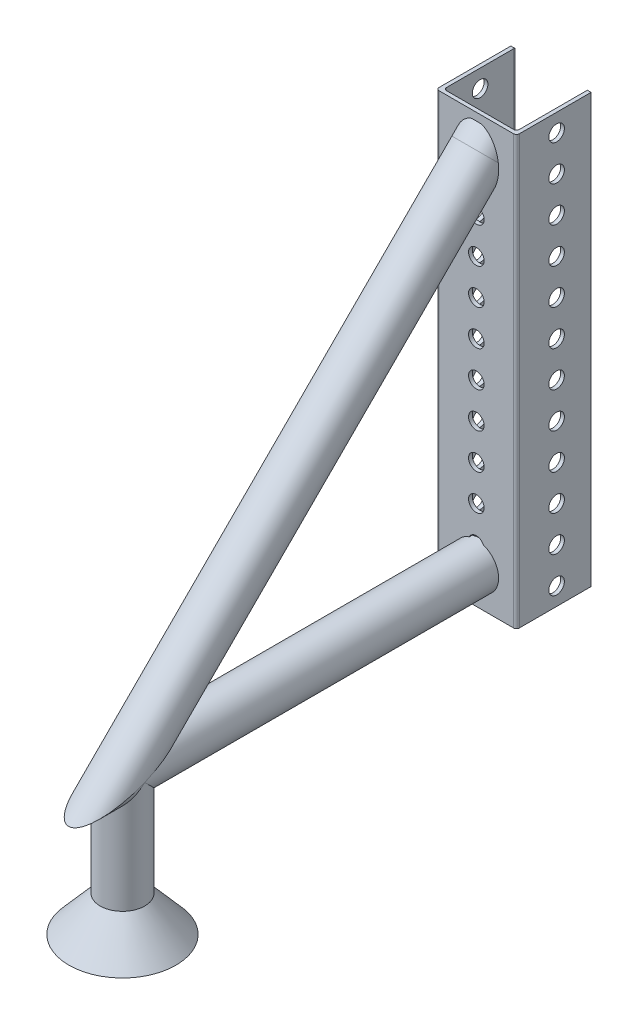
from build123d import *

# Parameters (mm, degrees)
BOSS_EXTRUDE1_DEPTH             = 304.8
SKETCH2_R                       = 5.55625
CUT_EXTRUDE1_DEPTH              = 304.8
SKETCH3_R                       = 5.55625
CUT_EXTRUDE2_DEPTH              = 304.8
SKETCH4_W                       = 57.15
SKETCH4_H                       = 304.8
CUT_EXTRUDE3_DEPTH              = 4
SWEEP1_PROFILE_R                = 15.875
BOSS_EXTRUDE2_REACH             = 426.804
BOSS_EXTRUDE2_END_RADIUS        = 15.875
SKETCH18_R                      = 15.875
BOSS_EXTRUDE2_DIRECTION_2_DEPTH = 25.4


with BuildPart() as part:
    # Sketch1 → Boss-Extrude1 (new body)
    with BuildSketch(Plane(origin=(0, 0, 0), x_dir=(1, 0, 0), z_dir=(0, 1, 0))):
        with BuildLine():
            Line((2, 0), (55.15, 0))
            ThreePointArc((55.15, 0), (56.564213562, 0.585786438), (57.15, 2))
            Line((57.15, 2), (57.15, 55.15))
            ThreePointArc((57.15, 55.15), (56.564213562, 56.564213562), (55.15, 57.15))
            Line((55.15, 57.15), (2, 57.15))
            ThreePointArc((2, 57.15), (0.585786438, 56.564213562), (0, 55.15))
            Line((0, 55.15), (0, 2))
            ThreePointArc((0, 2), (0.585786438, 0.585786438), (2, 0))
        make_face()
        with BuildLine():
            Line((4.667, 54.483), (52.483, 54.483))
            ThreePointArc((52.483, 54.483), (53.897213562, 53.897213562), (54.483, 52.483))
            Line((54.483, 52.483), (54.483, 4.667))
            ThreePointArc((54.483, 4.667), (53.897213562, 3.252786438), (52.483, 2.667))
            Line((52.483, 2.667), (4.667, 2.667))
            ThreePointArc((4.667, 2.667), (3.252786438, 3.252786438), (2.667, 4.667))
            Line((2.667, 4.667), (2.667, 52.483))
            ThreePointArc((2.667, 52.483), (3.252786438, 53.897213562), (4.667, 54.483))
        make_face(mode=Mode.SUBTRACT)
    extrude(amount=BOSS_EXTRUDE1_DEPTH)

    # Sketch2 → Cut-Extrude1 (cut)
    with BuildSketch(Plane.XY):
        with Locations((28.575, 292.1)):
            Circle(SKETCH2_R)
        with Locations((28.575, 266.7)):
            Circle(SKETCH2_R)
        with Locations((28.575, 241.3)):
            Circle(SKETCH2_R)
        with Locations((28.575, 215.9)):
            Circle(SKETCH2_R)
        with Locations((28.575, 190.5)):
            Circle(SKETCH2_R)
        with Locations((28.575, 165.1)):
            Circle(SKETCH2_R)
        with Locations((28.575, 139.7)):
            Circle(SKETCH2_R)
        with Locations((28.575, 114.3)):
            Circle(SKETCH2_R)
        with Locations((28.575, 88.9)):
            Circle(SKETCH2_R)
        with Locations((28.575, 63.5)):
            Circle(SKETCH2_R)
        with Locations((28.575, 38.1)):
            Circle(SKETCH2_R)
        with Locations((28.575, 12.7)):
            Circle(SKETCH2_R)
    extrude(amount=-CUT_EXTRUDE1_DEPTH, mode=Mode.SUBTRACT)

    # Sketch3 → Cut-Extrude2 (cut)
    with BuildSketch(Plane(origin=(57.15, 0, -57.15), x_dir=(0, 0, 1), z_dir=(-1, 0, 0))):
        with Locations((28.575, 292.1)):
            Circle(SKETCH3_R)
        with Locations((28.575, 266.7)):
            Circle(SKETCH3_R)
        with Locations((28.575, 241.3)):
            Circle(SKETCH3_R)
        with Locations((28.575, 215.9)):
            Circle(SKETCH3_R)
        with Locations((28.575, 190.5)):
            Circle(SKETCH3_R)
        with Locations((28.575, 165.1)):
            Circle(SKETCH3_R)
        with Locations((28.575, 139.7)):
            Circle(SKETCH3_R)
        with Locations((28.575, 114.3)):
            Circle(SKETCH3_R)
        with Locations((28.575, 88.9)):
            Circle(SKETCH3_R)
        with Locations((28.575, 63.5)):
            Circle(SKETCH3_R)
        with Locations((28.575, 38.1)):
            Circle(SKETCH3_R)
        with Locations((28.575, 12.7)):
            Circle(SKETCH3_R)
    extrude(amount=CUT_EXTRUDE2_DEPTH, mode=Mode.SUBTRACT)

    # Sketch4 → Cut-Extrude3 (cut)
    with BuildSketch(Plane(origin=(0, 0, -57.15), x_dir=(-1, 0, 0), z_dir=(0, 0, -1))):
        with Locations((-28.575, 152.4)):
            Rectangle(SKETCH4_W, SKETCH4_H)
    extrude(amount=-CUT_EXTRUDE3_DEPTH, mode=Mode.SUBTRACT)

    # Sweep1: sweep along a path in Sketch5
    with BuildLine(Plane(origin=(28.575, 0, 0), x_dir=(0, 0, -1), z_dir=(1, 0, 0))) as sweep1_path:
        Line((2, 25.4), (-252, 25.4))
        Line((-252, 25.4), (2, 279.4))
        Line((2, 279.4), (10.980256121, 288.380256121))
    # Sweep1 profile (on start of the path) → Sweep1 (sweep)
    with BuildSketch(Plane(origin=(28.575, 25.4, -2), x_dir=(1, 0, 0), z_dir=(0, 0, 1))):
        Circle(SWEEP1_PROFILE_R)
    sweep(path=sweep1_path.line, transition=Transition.RIGHT)

    # Boss-Extrude2: up to this cylinder (the profile starts outside it)
    boss_extrude2_end = Plane(origin=(28.575, 25.4, 252), z_dir=(0, 0, -1)) * Cylinder(BOSS_EXTRUDE2_END_RADIUS, 886.358, mode=Mode.PRIVATE)
    # Sketch18 → Boss-Extrude2 (add, up to the surface)
    with BuildSketch(Plane(origin=(0, 0, 0), x_dir=(1, 0, 0), z_dir=(0, 1, 0)), mode=Mode.PRIVATE) as boss_extrude2_sk1:
        with Locations((28.575, -252)):
            Circle(SKETCH18_R)
    boss_extrude2_tool1 = extrude(boss_extrude2_sk1.sketch, amount=BOSS_EXTRUDE2_REACH, mode=Mode.PRIVATE) - boss_extrude2_end
    add(boss_extrude2_tool1.solids().sort_by_distance((28.575, 0, 252))[0])

    # Sketch18 → Boss-Extrude2 direction 2 (add)
    with BuildSketch(Plane(origin=(0, 0, 0), x_dir=(1, 0, 0), z_dir=(0, 1, 0))):
        with Locations((28.575, -252)):
            Circle(SKETCH18_R)
    extrude(amount=-BOSS_EXTRUDE2_DIRECTION_2_DEPTH)

    # Sketch19 → Revolve1 (revolve)
    with BuildSketch(Plane(origin=(28.575, 0, 0), x_dir=(0, 0, -1), z_dir=(1, 0, 0))):
        Polygon((-236.125, -25.4), (-236.125, -50.8), (-213.9, -76.2), (-252, -76.2), (-252, -25.4), align=None)
    revolve(axis=Axis((28.575, -25.4, 252), (0, -1, 0)))


solid = part.part
